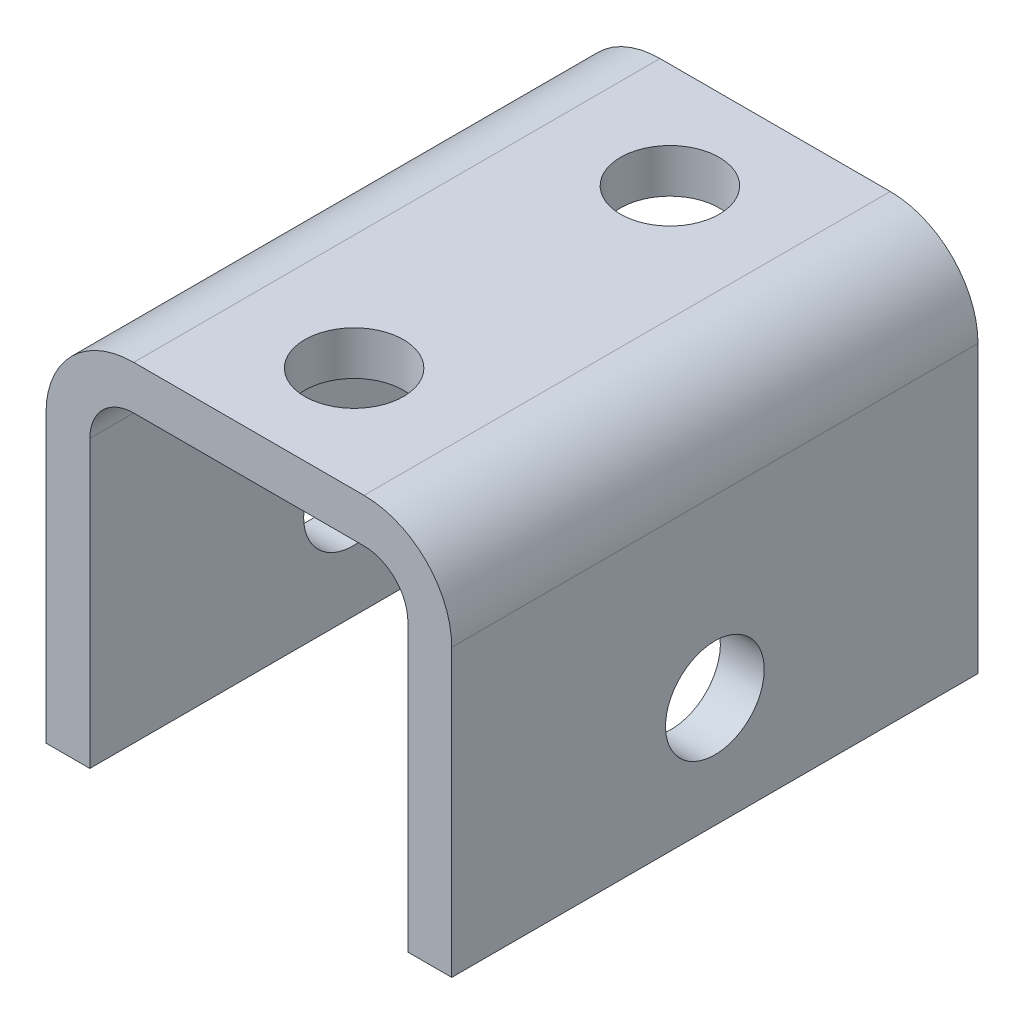
from build123d import *

# Parameters (mm, degrees)
BOSS_EXTRUDE1_DEPTH = 38.1
SKETCH2_R           = 7.14375
CUT_EXTRUDE1_DEPTH  = 89.488543914
SKETCH3_R           = 7.14375
CUT_EXTRUDE2_DEPTH  = 73.398431641


with BuildPart() as part:
    # Sketch1 → Boss-Extrude1 (new, symmetric)
    with BuildSketch(Plane.XY):
        with BuildLine():
            Line((-23.0251, -12.7), (-23.0251, -54.102))
            Line((-23.0251, -54.102), (-29.3751, -54.102))
            Line((-29.3751, -54.102), (-29.3751, -12.7))
            ThreePointArc((-29.3751, -12.7), (-25.655356121, -3.719743879), (-16.6751, 0))
            Line((-16.6751, 0), (16.6751, 0))
            ThreePointArc((16.6751, 0), (25.655356121, -3.719743879), (29.3751, -12.7))
            Line((29.3751, -12.7), (29.3751, -54.102))
            Line((29.3751, -54.102), (23.0251, -54.102))
            Line((23.0251, -54.102), (23.0251, -12.7))
            ThreePointArc((23.0251, -12.7), (21.165228061, -8.209871939), (16.6751, -6.35))
            Line((16.6751, -6.35), (-16.6751, -6.35))
            ThreePointArc((-16.6751, -6.35), (-21.165228061, -8.209871939), (-23.0251, -12.7))
        make_face()
    extrude(amount=BOSS_EXTRUDE1_DEPTH, both=True)

    # Sketch2 → Cut-Extrude1 (cut, through all)
    with BuildSketch(Plane(origin=(29.3751, 0, 0), x_dir=(0, 0, -1), z_dir=(1, 0, 0))):
        with Locations(Location((0, -38.1, 0), (0, 0, 90))):
            Circle(SKETCH2_R)
    extrude(amount=-CUT_EXTRUDE1_DEPTH, mode=Mode.SUBTRACT)

    # Sketch3 → Cut-Extrude2 (cut, through all)
    with BuildSketch(Plane(origin=(0, 0, 0), x_dir=(1, 0, 0), z_dir=(0, 1, 0))):
        with Locations(Location((0, 22.86, 0), (0, 0, 270))):
            Circle(SKETCH3_R)
        with Locations(Location((0, -22.86, 0), (0, 0, 270))):
            Circle(SKETCH3_R)
    extrude(amount=-CUT_EXTRUDE2_DEPTH, mode=Mode.SUBTRACT)


solid = part.part
